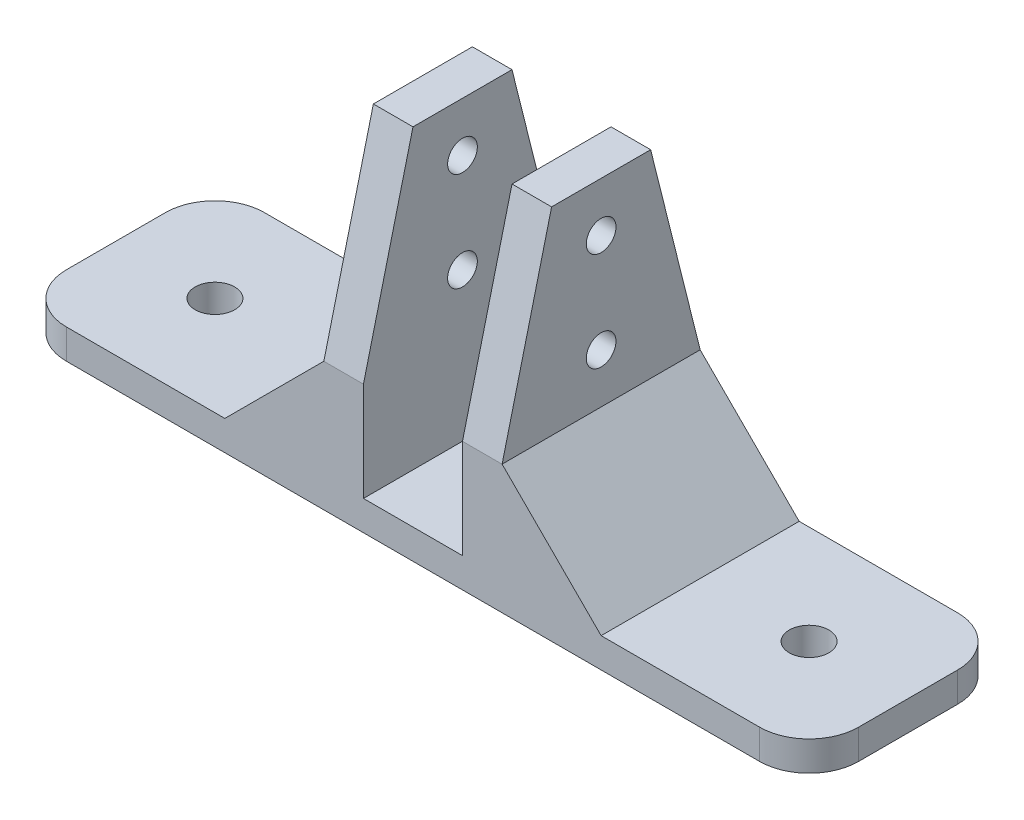
from build123d import *

# Parameters (mm, degrees)
SKETCH_2_W            = 80
SKETCH_2_H            = 20
EXTRUDE_1_DEPTH       = 3
EXTRUDE_2_DEPTH       = 20
HOLE_WIZARD_3_0_3_1_D = 3
HOLE_WIZARD_4_0_4_1_D = 4
CUT_EXTRUDE_1_DEPTH   = 200
FILLET_1_R            = 5


with BuildPart() as part:
    # 草图2 → 凸台-拉伸1 (new body)
    with BuildSketch(Plane(origin=(0, 0, 0), x_dir=(1, 0, 0), z_dir=(0, 1, 0))):
        Rectangle(SKETCH_2_W, SKETCH_2_H)
    extrude(amount=EXTRUDE_1_DEPTH)

    # 草图3 → 凸台-拉伸2 (add)
    with BuildSketch(Plane.XY.offset(10)):
        Polygon((-9, 13), (-19, 3), (-5, 3), (-5, 33), (-9, 33), align=None)
    extrude_2 = extrude(amount=-EXTRUDE_2_DEPTH)

    # 镜向1: 凸台-拉伸2 across plane
    add(extrude_2.mirror(Plane.ZY))

    # Ø3.0 (3) 直径孔1 (through all)
    with Locations(Plane.ZY.offset(9)):
        with Locations((0, 28), (0, 18)):
            Hole(HOLE_WIZARD_3_0_3_1_D / 2)

    # Ø4.0 (4) 直径孔1 (through all)
    with Locations(Plane(origin=(0, 3, 0), x_dir=(1, 0, 0), z_dir=(0, 1, 0))):
        with Locations((-30, 0), (30, 0)):
            Hole(HOLE_WIZARD_4_0_4_1_D / 2)

    # 草图10 → 切除-拉伸1 (cut)
    with BuildSketch(Plane.ZY.offset(9)):
        Polygon((10, 13), (10, 33), (5, 33), align=None)
        Polygon((-10, 13), (-10, 33), (-5, 33), align=None)
    extrude(amount=-CUT_EXTRUDE_1_DEPTH, mode=Mode.SUBTRACT)

    # 圆角1
    fillet_1_edges = [part.edges().sort_by_distance(p)[0] for p in [
        (40, 1.5, -10),
        (40, 1.5, 10),
        (-40, 1.5, 10),
        (-40, 1.5, -10),
    ]]
    fillet(fillet_1_edges, radius=FILLET_1_R)


solid = part.part
